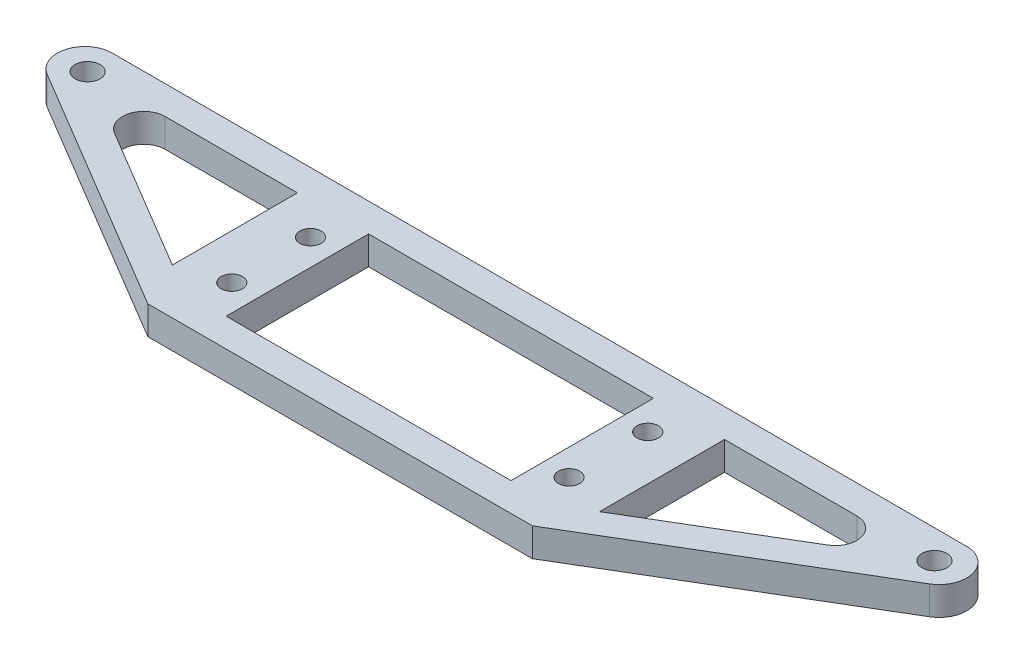
from build123d import *

# Parameters (mm, degrees)
SKETCH_1_R          = 1.5
SKETCH_1_W          = 40
SKETCH_1_H          = 20
EXTRUDE_1_DEPTH     = 4
FILLET_1_R          = 3
FILLET_2_R          = 3
SKETCH_2_R          = 1.75
CUT_EXTRUDE_1_DEPTH = 67.130086355


with BuildPart() as part:
    # 草图1 → 凸台-拉伸1 (new body)
    with BuildSketch(Plane(origin=(0, 0, 0), x_dir=(1, 0, 0), z_dir=(0, 1, 0))):
        with BuildLine():
            Line((-27, -14), (27, -14))
            Line((27, -14), (61.972111671, 6.837249964))
            ThreePointArc((61.972111671, 6.837249964), (63.714640377, 11.169883003), (60, 14))
            Line((60, 14), (27, 14))
            Line((27, 14), (-27, 14))
            Line((-27, 14), (-60, 14))
            ThreePointArc((-60, 14), (-63.714640377, 11.169883003), (-61.972111671, 6.837249964))
            Line((-61.972111671, 6.837249964), (-27, -14))
        make_face()
        with Locations(Location((-23.680960464, 5.529497849, 0), (0, 0, 270))):
            Circle(SKETCH_1_R, mode=Mode.SUBTRACT)
        with Locations(Location((-23.680960464, -5.529497849, 0), (0, 0, 90))):
            Circle(SKETCH_1_R, mode=Mode.SUBTRACT)
        with Locations(Location((23.680960464, -5.529497849, 0), (0, 0, 270))):
            Circle(SKETCH_1_R, mode=Mode.SUBTRACT)
        with Locations(Location((23.680960464, 5.529497849, 0), (0, 0, 90))):
            Circle(SKETCH_1_R, mode=Mode.SUBTRACT)
        Rectangle(SKETCH_1_W, SKETCH_1_H, mode=Mode.SUBTRACT)
        Polygon((30, 10), (59.465601315, 10), (30, -7.556334765), align=None, mode=Mode.SUBTRACT)
        Polygon((-59.465601315, 10), (-30, -7.556334765), (-30, 10), align=None, mode=Mode.SUBTRACT)
    extrude(amount=EXTRUDE_1_DEPTH)

    # 圆角1
    fillet_1_edges = [part.edges().sort_by_distance(p)[0] for p in [
        (59.465601315, 2, -10),
    ]]
    fillet(fillet_1_edges, radius=FILLET_1_R)

    # 圆角2
    fillet_2_edges = [part.edges().sort_by_distance(p)[0] for p in [
        (-59.465601315, 2, -10),
    ]]
    fillet(fillet_2_edges, radius=FILLET_2_R)

    # 草图2 → 切除-拉伸1 (cut, through all)
    with BuildSketch(Plane(origin=(0, 10, 0), x_dir=(1, 0, 0), z_dir=(0, 1, 0))):
        with Locations(Location((-59.465601315, 10, 0), (0, 0, 270))):
            Circle(SKETCH_2_R)
        with Locations(Location((59.465601315, 10, 0), (0, 0, 270))):
            Circle(SKETCH_2_R)
    extrude(amount=-CUT_EXTRUDE_1_DEPTH, mode=Mode.SUBTRACT)


solid = part.part
